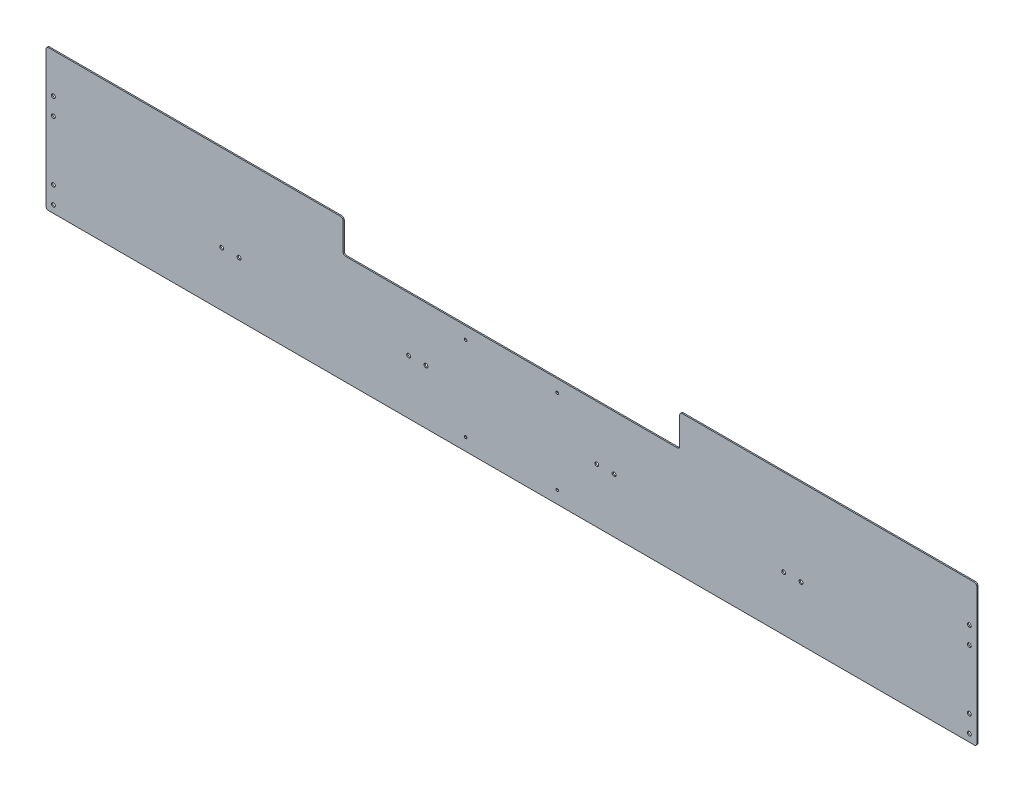
from build123d import *

# Parameters (mm, degrees)
BOSS_EXTRUDE1_DEPTH              = 1.5875
F_25_64_0_39063_DIAMETER_HOLE1_D = 9.922002
FILLET1_R                        = 6.35
F_1_4_CLEARANCE_HOLE2_D          = 6.7564


with BuildPart() as part:
    # Sketch1 → Boss-Extrude1 (new, symmetric)
    with BuildSketch(Plane.XY):
        Polygon((-431.8, 222.25), (-1193.8, 222.25), (-1193.8, 139.7), (-1193.8, -139.7), (1193.8, -139.7), (1193.8, 139.7), (1193.8, 222.25), (431.8, 222.25), (431.8, 139.7), (-431.8, 139.7), align=None)
    extrude(amount=BOSS_EXTRUDE1_DEPTH, both=True)

    # 25/64 (0.39063) Diameter Hole1 (through all)
    with Locations(Plane.XY.offset(1.5875)):
        with Locations((-1174.75, 120.65), (-1174.75, -120.65), (1174.75, 120.65), (1174.75, -120.65), (-742.95, 0), (-698.5, 0), (-263.525, 0), (-219.075, 0), (742.95, 0), (698.5, 0), (263.525, 0), (219.075, 0), (1174.75, -76.2), (1174.75, 76.2), (-1174.75, 76.2), (-1174.75, -76.2)):
            Hole(F_25_64_0_39063_DIAMETER_HOLE1_D / 2)

    # Fillet1
    fillet1_edges = [part.edges().sort_by_distance(p)[0] for p in [
        (1193.8, -139.7, 0),
        (-1193.8, -139.7, 0),
        (-1193.8, 222.25, 0),
        (-431.8, 222.25, 0),
        (-431.8, 139.7, 0),
        (431.8, 139.7, 0),
        (431.8, 222.25, 0),
        (1193.8, 222.25, 0),
    ]]
    fillet(fillet1_edges, radius=FILLET1_R)

    # 1/4 Clearance Hole2 (through all)
    with Locations(Plane.XY.offset(1.5875)):
        with Locations((-117.475, 107.95), (-117.475, -107.95), (117.475, 107.95), (117.475, -107.95)):
            Hole(F_1_4_CLEARANCE_HOLE2_D / 2)


solid = part.part
